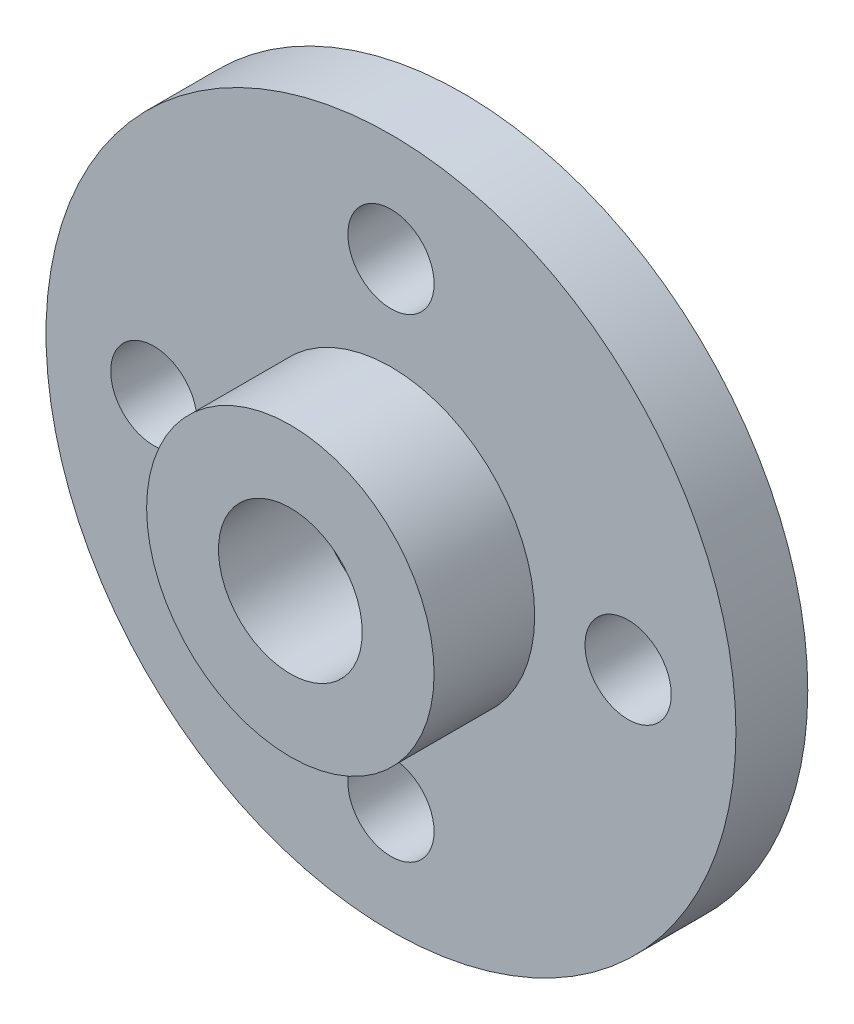
from build123d import *

# Parameters (mm, degrees)
SKETCH_1_R      = 12
SKETCH_1_R_2    = 1.5
EXTRUDE_1_DEPTH = 2.5
SKETCH_2_R      = 5
SKETCH_2_R_2    = 2.5
EXTRUDE_2_DEPTH = 3.5


with BuildPart() as part:
    # 草图1 → 凸台-拉伸1 (new body)
    with BuildSketch(Plane.XY):
        Circle(SKETCH_1_R)
        Circle(SKETCH_1_R_2, mode=Mode.SUBTRACT)
        with Locations((0, 8.25)):
            Circle(SKETCH_1_R_2, mode=Mode.SUBTRACT)
        with Locations((8.25, 0)):
            Circle(SKETCH_1_R_2, mode=Mode.SUBTRACT)
        with Locations((0, -8.25)):
            Circle(SKETCH_1_R_2, mode=Mode.SUBTRACT)
        with Locations((-8.25, 0)):
            Circle(SKETCH_1_R_2, mode=Mode.SUBTRACT)
    extrude(amount=EXTRUDE_1_DEPTH)

    # 草图2 → 凸台-拉伸2 (add)
    with BuildSketch(Plane.XY.offset(2.5)):
        Circle(SKETCH_2_R)
        Circle(SKETCH_2_R_2, mode=Mode.SUBTRACT)
    extrude(amount=EXTRUDE_2_DEPTH)


solid = part.part
